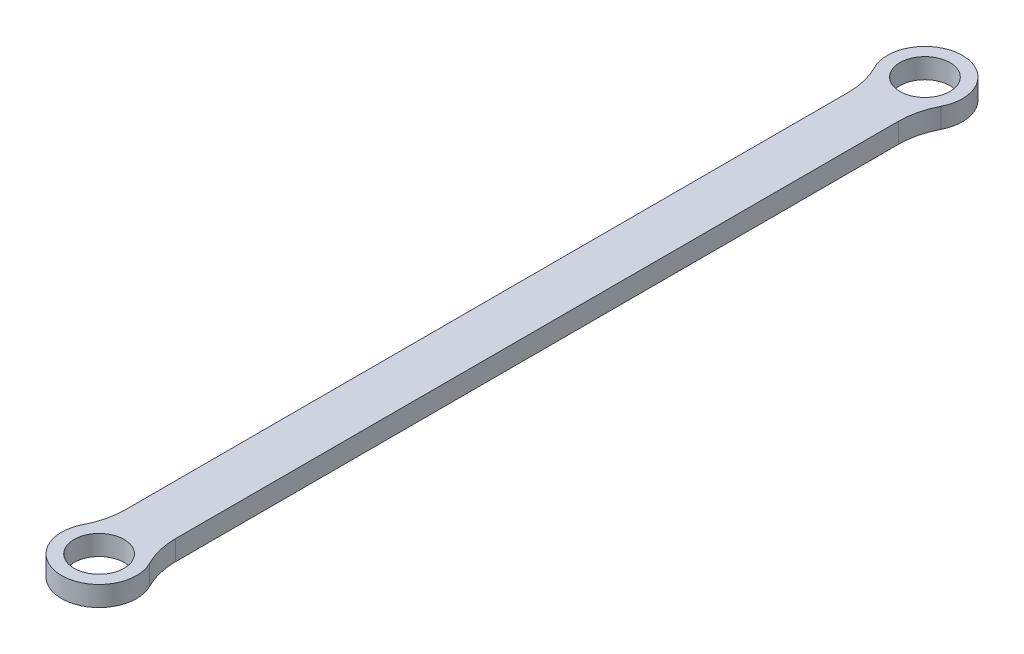
from build123d import *

# Parameters (mm, degrees)
SKETCH1_R           = 5
BOSS_EXTRUDE1_DEPTH = 4
FILLET1_R           = 15


with BuildPart() as part:
    # Sketch1 → Boss-Extrude1 (new body)
    with BuildSketch(Plane(origin=(0, 0, 0), x_dir=(1, 0, 0), z_dir=(0, 1, 0))):
        with BuildLine():
            ThreePointArc((-5, -76.909830056), (0, -90), (5, -76.909830056))
            Line((5, -76.909830056), (5, 76.909830056))
            ThreePointArc((5, 76.909830056), (0, 90), (-5, 76.909830056))
            Line((-5, 76.909830056), (-5, -76.909830056))
        make_face()
        with Locations(Location((0, -82.5, 0), (0, 0, 270))):
            Circle(SKETCH1_R, mode=Mode.SUBTRACT)
        with Locations(Location((0, 82.5, 0), (0, 0, 270))):
            Circle(SKETCH1_R, mode=Mode.SUBTRACT)
    extrude(amount=BOSS_EXTRUDE1_DEPTH)

    # Fillet1
    fillet1_edges = [part.edges().sort_by_distance(p)[0] for p in [
        (-5, 2, 76.909830056),
        (-5, 2, -76.909830056),
        (5, 2, -76.909830056),
        (5, 2, 76.909830056),
    ]]
    fillet(fillet1_edges, radius=FILLET1_R)


solid = part.part
